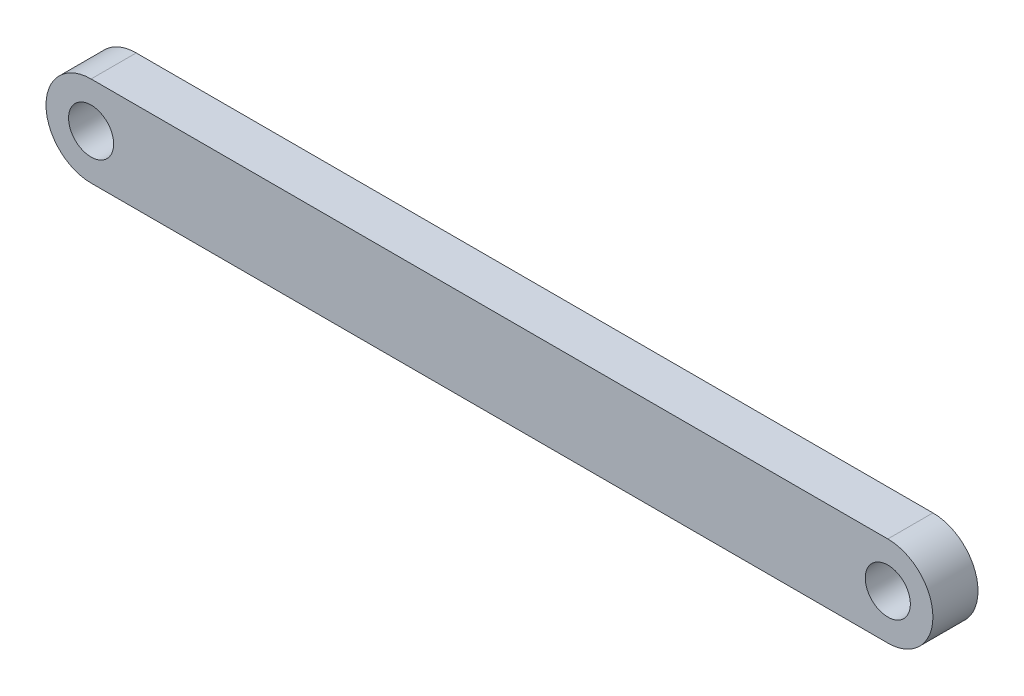
from build123d import *

# Parameters (mm, degrees)
SKETCH2_R           = 1.5
BOSS_EXTRUDE1_DEPTH = 3


with BuildPart() as part:
    # Sketch2 → Boss-Extrude1 (new body)
    with BuildSketch(Plane.XY):
        with BuildLine():
            Line((-53, 3), (0, 3))
            ThreePointArc((0, 3), (3, 0), (0, -3))
            Line((0, -3), (-53, -3))
            ThreePointArc((-53, -3), (-56, 0), (-53, 3))
        make_face()
        with Locations((-53, 0)):
            Circle(SKETCH2_R, mode=Mode.SUBTRACT)
        Circle(SKETCH2_R, mode=Mode.SUBTRACT)
    extrude(amount=BOSS_EXTRUDE1_DEPTH)


solid = part.part
